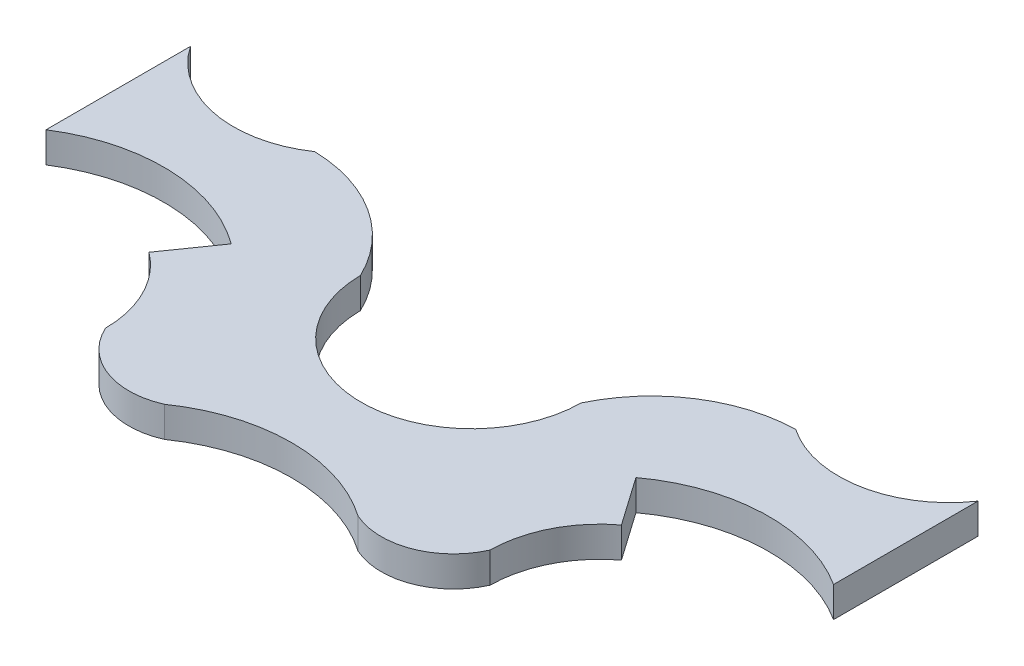
from build123d import *

# Parameters (mm, degrees)
BOSS_EXTRUDE1_DEPTH = 2
SKETCH5_W           = 68.030538665
SKETCH5_H           = 29.277015507
CUT_EXTRUDE3_DEPTH  = 2


with BuildPart() as part:
    # Sketch3 → Boss-Extrude1 (new body)
    with BuildSketch(Plane(origin=(0, 0, 0), x_dir=(1, 0, 0), z_dir=(0, 1, 0))):
        with BuildLine():
            Line((-13.637639272, 20.383278482), (-15.860247962, 17.20906431))
            ThreePointArc((-15.860247962, 17.20906431), (-13.666207185, 14.707240293), (-12.875283017, 11.475))
            ThreePointArc((-12.875283017, 11.475), (-10.092914311, 8.804356775), (-6.237643745, 8.908278482))
            ThreePointArc((-6.237643745, 8.908278482), (0, 10.875), (6.237643745, 8.908278482))
            ThreePointArc((6.237643745, 8.908278482), (10.092914311, 8.804356775), (12.875283017, 11.475))
            ThreePointArc((12.875283017, 11.475), (13.666207185, 14.707240293), (15.860247962, 17.20906431))
            Line((15.860247962, 17.20906431), (13.637639272, 20.383278482))
            ThreePointArc((13.637639272, 20.383278482), (19.875283017, 22.35), (26.112926762, 20.383278482))
            Line((26.112926762, 20.383278482), (26.112926762, 31.248240565))
            ThreePointArc((26.112926762, 31.248240565), (21.575193898, 27.634543241), (15.870079226, 28.68406431))
            ThreePointArc((15.870079226, 28.68406431), (10.616247764, 27.083629141), (7, 22.95))
            ThreePointArc((7, 22.95), (0, 15.95), (-7, 22.95))
            ThreePointArc((-7, 22.95), (-10.616247764, 27.083629141), (-15.870079226, 28.68406431))
            ThreePointArc((-15.870079226, 28.68406431), (-21.575193898, 27.634543241), (-26.112926762, 31.248240565))
            Line((-26.112926762, 31.248240565), (-26.112926762, 20.383278482))
            ThreePointArc((-26.112926762, 20.383278482), (-19.875283017, 22.35), (-13.637639272, 20.383278482))
        make_face()
    extrude(amount=BOSS_EXTRUDE1_DEPTH)

    # Sketch5 → Cut-Extrude3 (cut)
    with BuildSketch(Plane(origin=(0, 2, 0), x_dir=(1, 0, 0), z_dir=(0, 1, 0))):
        with Locations((1.906858247, 20.166215681)):
            Rectangle(SKETCH5_W, SKETCH5_H)
        with BuildLine():
            Line((25.862926762, 20.851233112), (25.862926762, 30.337137187))
            ThreePointArc((25.862926762, 30.337137187), (21.222970901, 27.301360666), (15.794718469, 28.432380125))
            ThreePointArc((15.794718469, 28.432380125), (10.741632002, 26.866985754), (7.249777379, 22.893184845))
            ThreePointArc((7.249777379, 22.893184845), (0, 15.7), (-7.249777379, 22.893184845))
            ThreePointArc((-7.249777379, 22.893184845), (-10.741632002, 26.866985754), (-15.794718469, 28.432380125))
            ThreePointArc((-15.794718469, 28.432380125), (-21.222970901, 27.301360666), (-25.862926762, 30.337137187))
            Line((-25.862926762, 30.337137187), (-25.862926762, 20.851233112))
            ThreePointArc((-25.862926762, 20.851233112), (-19.513666923, 22.594121314), (-13.291068525, 20.442371104))
            Line((-13.291068525, 20.442371104), (-15.51453889, 17.266926334))
            ThreePointArc((-15.51453889, 17.266926334), (-13.399579679, 14.735025503), (-12.625477511, 11.528104843))
            ThreePointArc((-12.625477511, 11.528104843), (-9.989809939, 9.032549256), (-6.361359115, 9.126814078))
            ThreePointArc((-6.361359115, 9.126814078), (0, 11.125), (6.361359115, 9.126814078))
            ThreePointArc((6.361359115, 9.126814078), (9.989809939, 9.032549256), (12.625477511, 11.528104843))
            ThreePointArc((12.625477511, 11.528104843), (13.399579679, 14.735025503), (15.51453889, 17.266926334))
            Line((15.51453889, 17.266926334), (13.291068525, 20.442371104))
            ThreePointArc((13.291068525, 20.442371104), (19.513666923, 22.594121314), (25.862926762, 20.851233112))
        make_face(mode=Mode.SUBTRACT)
    extrude(amount=-CUT_EXTRUDE3_DEPTH, mode=Mode.SUBTRACT)


solid = part.part
